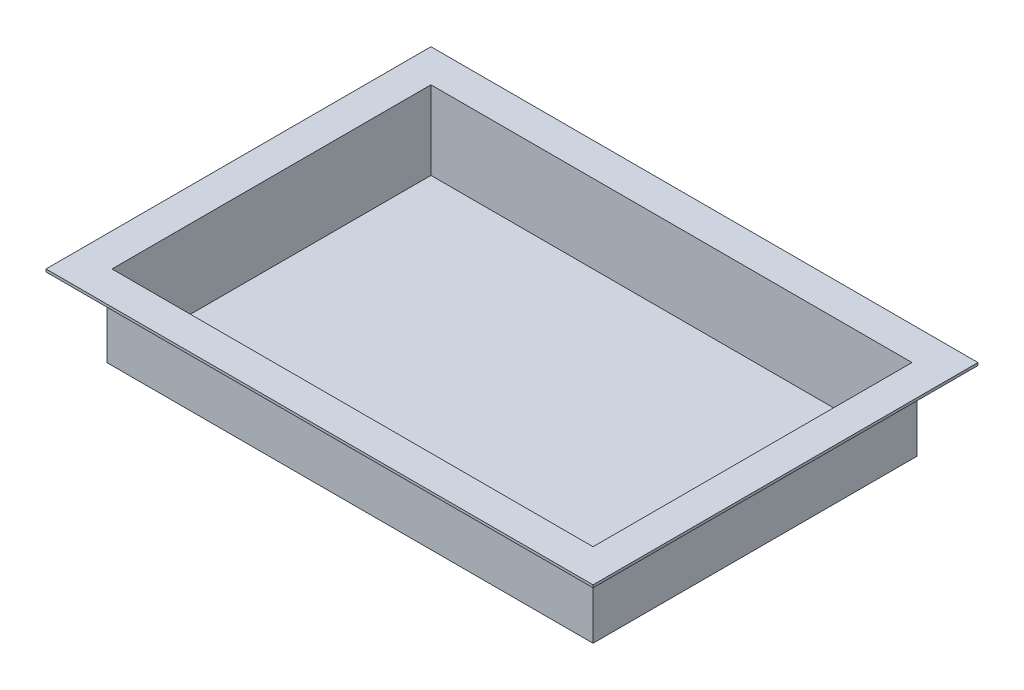
from build123d import *

# Parameters (mm, degrees)
SKETCH1_W           = 152.4
SKETCH1_H           = 101.6
BOSS_EXTRUDE1_DEPTH = 25.4
SHELL1_T            = -0.8128
SKETCH3_W           = 171.45
SKETCH3_H           = 120.65
SKETCH3_W_2         = 152.4
SKETCH3_H_2         = 101.6
BOSS_EXTRUDE2_DEPTH = 0.8128


with BuildPart() as part:
    # Sketch1 → Boss-Extrude1 (new body)
    with BuildSketch(Plane(origin=(0, 0, 0), x_dir=(1, 0, 0), z_dir=(0, 1, 0))):
        Rectangle(SKETCH1_W, SKETCH1_H)
    extrude(amount=-BOSS_EXTRUDE1_DEPTH)

    # Shell1
    shell1_openings = [part.faces().sort_by_distance(p)[0] for p in [
        (0, 0, 0),
    ]]
    offset(amount=SHELL1_T, openings=shell1_openings, kind=Kind.INTERSECTION)

    # Sketch3 → Boss-Extrude2 (add)
    with BuildSketch(Plane(origin=(0, 0, 0), x_dir=(1, 0, 0), z_dir=(0, 1, 0))):
        Rectangle(SKETCH3_W, SKETCH3_H)
        Rectangle(SKETCH3_W_2, SKETCH3_H_2, mode=Mode.SUBTRACT)
    extrude(amount=-BOSS_EXTRUDE2_DEPTH)


solid = part.part
